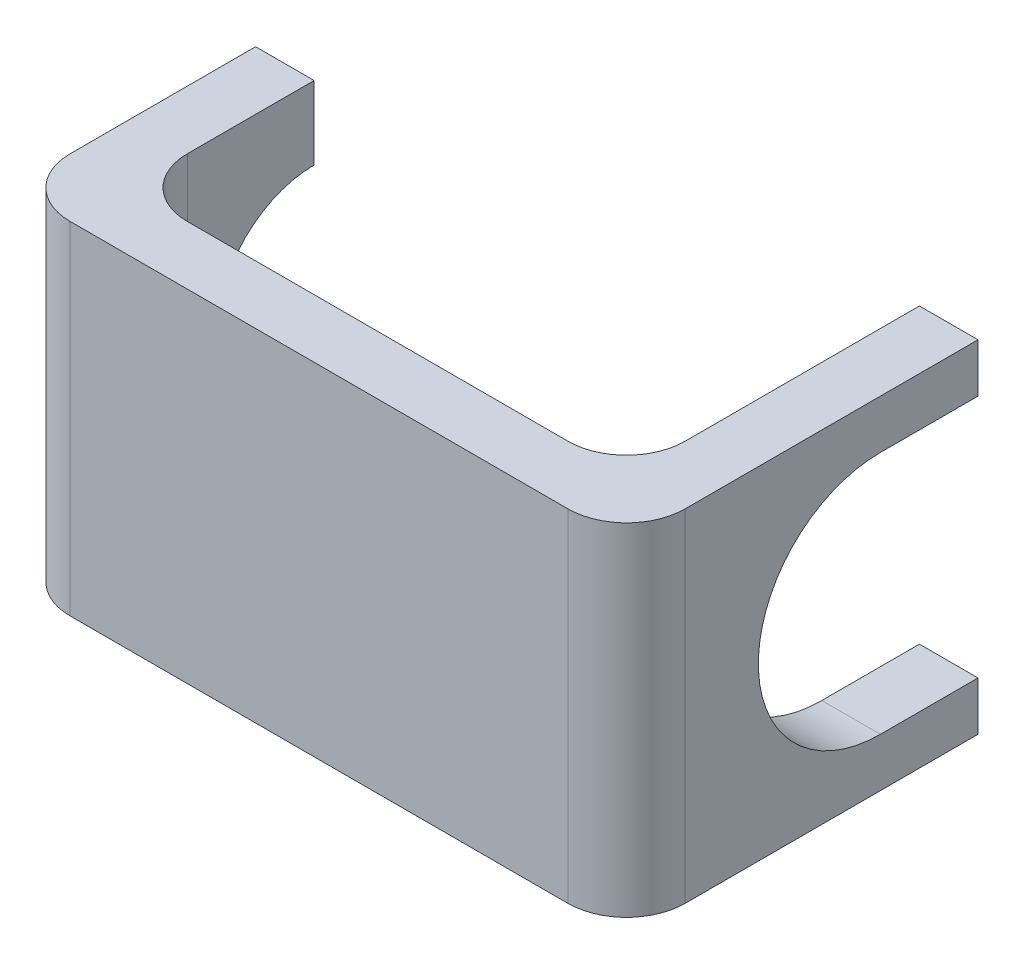
from build123d import *

# Parameters (mm, degrees)
BOSS_EXTRUDE1_DEPTH = 3.5
FILLET1_R           = 0.6
CUT_EXTRUDE1_DEPTH  = 4
CUT_EXTRUDE2_DEPTH  = 10


with BuildPart() as part:
    # Sketch1 → Boss-Extrude1 (new body)
    with BuildSketch(Plane(origin=(0, 0, 0), x_dir=(1, 0, 0), z_dir=(0, 1, 0))):
        Polygon((0, 0), (0, 1.9), (-0.6, 1.9), (-0.6, -0.6), (5.7, -0.6), (5.7, 3), (5.1, 3), (5.1, 0), align=None)
    extrude(amount=BOSS_EXTRUDE1_DEPTH)

    # Fillet1
    fillet1_edges = [part.edges().sort_by_distance(p)[0] for p in [
        (5.1, 1.75, 0),
        (5.7, 1.75, 0.6),
        (-0.6, 1.75, 0.6),
        (0, 1.75, 0),
    ]]
    fillet(fillet1_edges, radius=FILLET1_R)

    # Sketch2 → Cut-Extrude1 (cut)
    with BuildSketch(Plane(origin=(5.7, 0, 0), x_dir=(0, 0, -1), z_dir=(1, 0, 0))):
        with BuildLine():
            Line((2, 3), (3, 3))
            Line((3, 3), (3, 0.5))
            Line((3, 0.5), (2, 0.5))
            ThreePointArc((2, 0.5), (0.75, 1.75), (2, 3))
        make_face()
    extrude(amount=-CUT_EXTRUDE1_DEPTH, mode=Mode.SUBTRACT)

    # Sketch3 → Cut-Extrude2 (cut)
    with BuildSketch(Plane.ZY.offset(0.6)):
        with BuildLine():
            Line((-1.9, 0.75), (-1.9, 2.75))
            ThreePointArc((-1.9, 2.75), (-0.9, 1.75), (-1.9, 0.75))
        make_face()
    extrude(amount=-CUT_EXTRUDE2_DEPTH, mode=Mode.SUBTRACT)


solid = part.part
